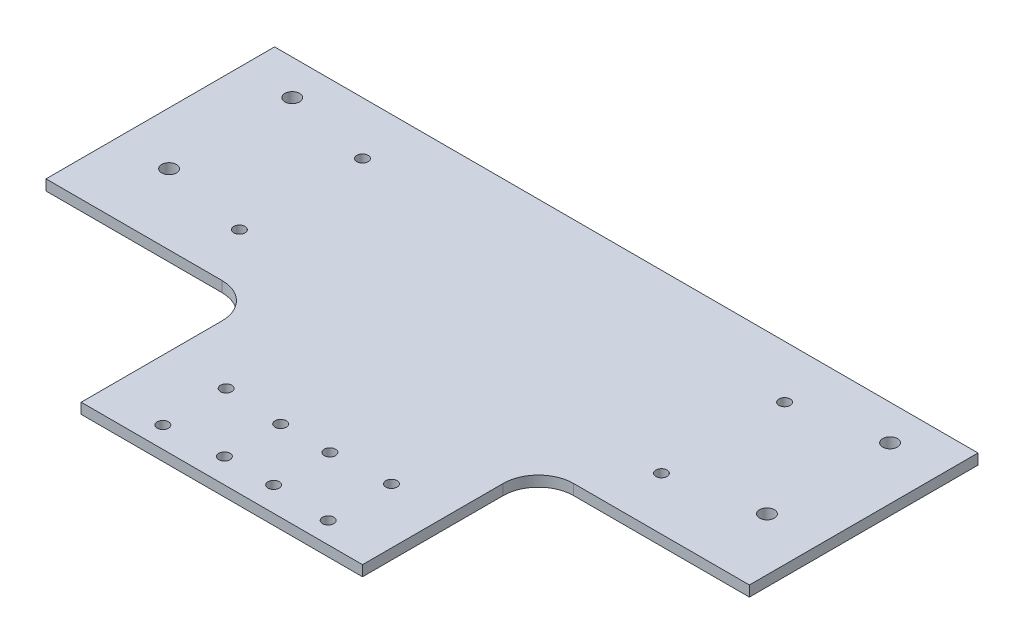
from build123d import *

# Parameters (mm, degrees)
SKETCH_1_W             = 200
SKETCH_1_H             = 65
SKETCH_1_R             = 2.1
SKETCH_1_W_2           = 80
SKETCH_1_H_2           = 50
EXTRUDE_1_DEPTH        = 3
SKETCH_2_R             = 1.6
CUT_EXTRUDE_1454_DEPTH = 130.673628776
SKETCH_3_R             = 1.6
CUT_EXTRUDE_2001_DEPTH = 130.673628776
FILLET_1_R             = 10


with BuildPart() as part:
    # 草图1 → 凸台-拉伸1 (new body)
    # profile 1 of 2: a face of its own
    with BuildSketch(Plane(origin=(0, 0, 0), x_dir=(1, 0, 0), z_dir=(0, 1, 0))):
        Rectangle(SKETCH_1_W, SKETCH_1_H)
        with Locations(Location((85, -12.5, 0), (0, 0, 270))):
            Circle(SKETCH_1_R, mode=Mode.SUBTRACT)
        with Locations(Location((-85, -12.5, 0), (0, 0, 270))):
            Circle(SKETCH_1_R, mode=Mode.SUBTRACT)
        with Locations(Location((-85, 22.5, 0), (0, 0, 270))):
            Circle(SKETCH_1_R, mode=Mode.SUBTRACT)
        with Locations(Location((85, 22.5, 0), (0, 0, 270))):
            Circle(SKETCH_1_R, mode=Mode.SUBTRACT)
    # profile 2 of 2: a face of its own
    with BuildSketch(Plane(origin=(0, 0, 0), x_dir=(1, 0, 0), z_dir=(0, 1, 0))):
        with Locations((0, -57.5)):
            Rectangle(SKETCH_1_W_2, SKETCH_1_H_2)
    extrude(amount=EXTRUDE_1_DEPTH)

    # 草图2 → Cut-Extrude 1454 (cut, through all)
    with BuildSketch(Plane(origin=(0, 3, 0), x_dir=(1, 0, 0), z_dir=(0, 1, 0))):
        with Locations(Location((-60, 17.5, 0), (0, 0, 270))):
            Circle(SKETCH_2_R)
        with Locations(Location((-60, -17.5, 0), (0, 0, 270))):
            Circle(SKETCH_2_R)
        with Locations(Location((60, -17.5, 0), (0, 0, 270))):
            Circle(SKETCH_2_R)
        with Locations(Location((60, 17.5, 0), (0, 0, 270))):
            Circle(SKETCH_2_R)
    extrude(amount=-CUT_EXTRUDE_1454_DEPTH, mode=Mode.SUBTRACT)

    # 草图3 → Cut-Extrude 2001 (cut, through all)
    with BuildSketch(Plane(origin=(0, 3, 0), x_dir=(1, 0, 0), z_dir=(0, 1, 0))):
        with Locations(Location((-22.773937698, -58.5, 0), (0, 0, 270))):
            Circle(SKETCH_3_R)
        with Locations(Location((24.226062302, -58.5, 0), (0, 0, 90))):
            Circle(SKETCH_3_R)
        with Locations(Location((24.226062302, -76.5, 0), (0, 0, 270))):
            Circle(SKETCH_3_R)
        with Locations(Location((-22.773937698, -76.5, 0), (0, 0, 90))):
            Circle(SKETCH_3_R)
        with Locations(Location((-6.273937698, -59.5, 0), (0, 0, 270))):
            Circle(SKETCH_3_R)
        with Locations(Location((7.726062302, -59.5, 0), (0, 0, 90))):
            Circle(SKETCH_3_R)
        with Locations(Location((7.726062302, -75.5, 0), (0, 0, 270))):
            Circle(SKETCH_3_R)
        with Locations(Location((-6.273937698, -75.5, 0), (0, 0, 90))):
            Circle(SKETCH_3_R)
    extrude(amount=-CUT_EXTRUDE_2001_DEPTH, mode=Mode.SUBTRACT)

    # 圆角1
    fillet_1_edges = [part.edges().sort_by_distance(p)[0] for p in [
        (40, 1.5, 32.5),
        (-40, 1.5, 32.5),
    ]]
    fillet(fillet_1_edges, radius=FILLET_1_R)


solid = part.part
